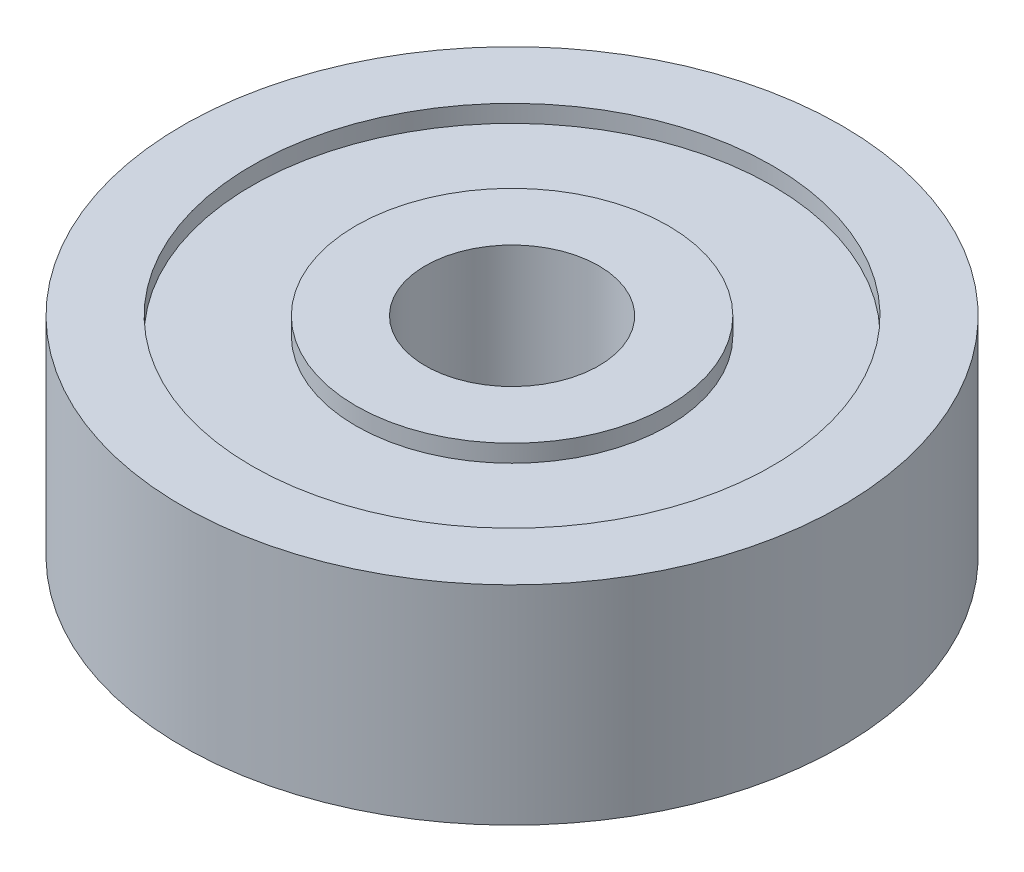
from build123d import *


with BuildPart() as part:
    # 草图1 → 旋转1 (revolve)
    with BuildSketch(Plane.XY, mode=Mode.PRIVATE) as revolve_1_sk:
        Polygon((2.5, 0), (2.5, 6), (4.5, 6), (4.5, 5.5), (7.5, 5.5), (7.5, 6), (9.5, 6), (9.5, 0), (7.5, 0), (7.5, 0.5), (4.5, 0.5), (4.5, 0), align=None)
    revolve(revolve_1_sk.sketch.rotate(Axis((0, 0, 0), (0, 1, 0)), 90), axis=Axis((0, 0, 0), (0, 1, 0)))


solid = part.part
